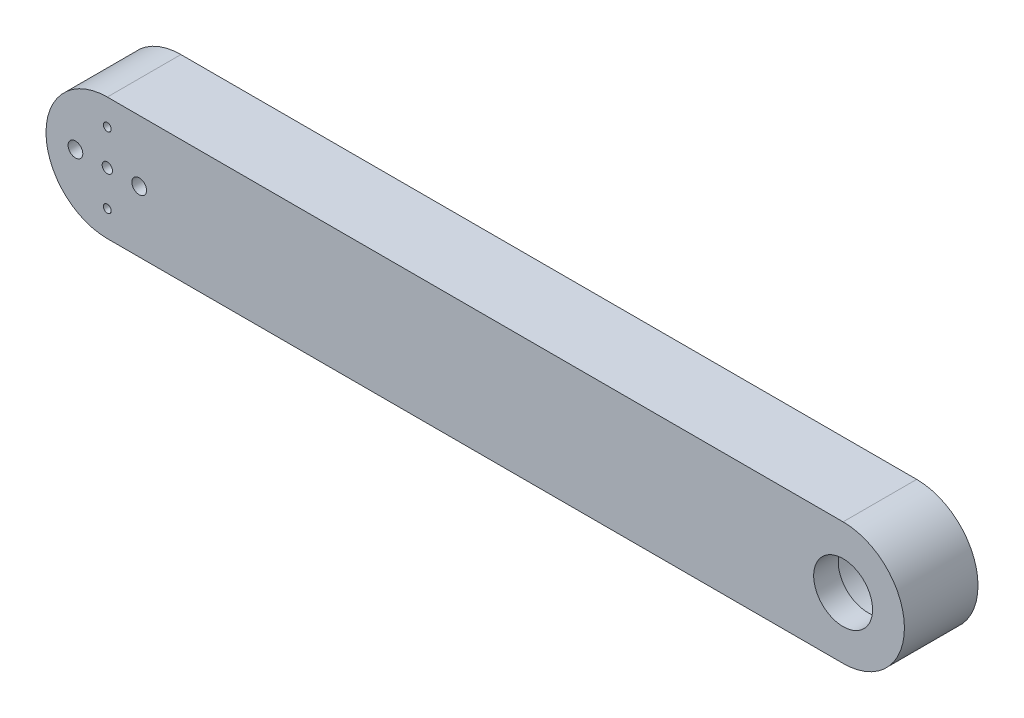
from build123d import *

# Parameters (mm, degrees)
EXTRUDE_1_DEPTH          = 15
CUT_EXTRUDE_3_DEPTH      = 90.652105385
CUT_EXTRUDE_3_DEPTH_BACK = 90.652105385
SKETCH_7_R               = 1.5
SKETCH_8_R               = 9.5
CUT_EXTRUDE_4_DEPTH      = 10
SKETCH_9_R               = 6
CUT_EXTRUDE_10_DEPTH     = 20
M2X0_4_1_D               = 1.6
M2X0_4_2_D               = 1.6


with BuildPart() as part:
    # ｽｹｯﾁ2 → ﾎﾞｽ - 押し出し1 (new body)
    with BuildSketch(Plane.XY):
        with BuildLine():
            ThreePointArc((-62.5, 0), (-66.161165235, 8.838834765), (-75, 12.5))
            Line((-75, 12.5), (-75, 1.05))
            ThreePointArc((-75, 1.05), (-74.25753788, 0.74246212), (-73.95, 0))
            ThreePointArc((-73.95, 0), (-74.25753788, -0.74246212), (-75, -1.05))
            Line((-75, -1.05), (-75, -12.5))
            ThreePointArc((-75, -12.5), (-66.161165235, -8.838834765), (-62.5, 0))
        make_face()
        with BuildLine():
            Line((-75, 1.05), (-75, 12.5))
            ThreePointArc((-75, 12.5), (-87.5, 0), (-75, -12.5))
            Line((-75, -12.5), (-75, -1.05))
            ThreePointArc((-75, -1.05), (-76.05, 0), (-75, 1.05))
        make_face()
        with BuildLine():
            Line((75, 12.5), (-75, 12.5))
            ThreePointArc((-75, 12.5), (-66.161165235, 8.838834765), (-62.5, 0))
            ThreePointArc((-62.5, 0), (-66.161165235, -8.838834765), (-75, -12.5))
            Line((-75, -12.5), (75, -12.5))
            ThreePointArc((75, -12.5), (62.5, 0), (75, 12.5))
        make_face()
        with BuildLine():
            ThreePointArc((87.5, 0), (83.838834765, 8.838834765), (75, 12.5))
            Line((75, 12.5), (75, 1.05))
            ThreePointArc((75, 1.05), (75.74246212, 0.74246212), (76.05, 0))
            ThreePointArc((76.05, 0), (75.74246212, -0.74246212), (75, -1.05))
            Line((75, -1.05), (75, -12.5))
            ThreePointArc((75, -12.5), (83.838834765, -8.838834765), (87.5, 0))
        make_face()
        with BuildLine():
            Line((75, 1.05), (75, 12.5))
            ThreePointArc((75, 12.5), (62.5, 0), (75, -12.5))
            Line((75, -12.5), (75, -1.05))
            ThreePointArc((75, -1.05), (73.95, 0), (75, 1.05))
        make_face()
    extrude(amount=EXTRUDE_1_DEPTH)

    # ｽｹｯﾁ7 → ｶｯﾄ - 押し出し3 (cut, two sides: drawn at the far end of the back side and taken through both)
    with BuildSketch(Plane.XY.offset(-CUT_EXTRUDE_3_DEPTH_BACK)):
        with Locations((-68.5, 0)):
            Circle(SKETCH_7_R)
        with Locations((-81.5, 0)):
            Circle(SKETCH_7_R)
    extrude(amount=CUT_EXTRUDE_3_DEPTH + CUT_EXTRUDE_3_DEPTH_BACK, mode=Mode.SUBTRACT)

    # ｽｹｯﾁ8 → ｶｯﾄ - 押し出し4 (cut)
    with BuildSketch(Plane.XY):
        with Locations((75, 0)):
            Circle(SKETCH_8_R)
    extrude(amount=CUT_EXTRUDE_4_DEPTH, mode=Mode.SUBTRACT)

    # ｽｹｯﾁ9 → ｶｯﾄ - 押し出し10 (cut)
    with BuildSketch(Plane.XY):
        with Locations((75, 0)):
            Circle(SKETCH_9_R)
    extrude(amount=CUT_EXTRUDE_10_DEPTH, mode=Mode.SUBTRACT)

    # M2x0.4 ねじ穴1 (through all)
    with Locations(Plane.XY.offset(15)):
        with Locations((-75, 7.2), (-67.8, 0), (-75, -7.2)):
            Hole(M2X0_4_1_D / 2)

    # M2x0.4 ねじ穴2 (through all)
    with Locations(Plane.XY.offset(15)):
        with Locations((-67.8, 0)):
            Hole(M2X0_4_2_D / 2)


solid = part.part
